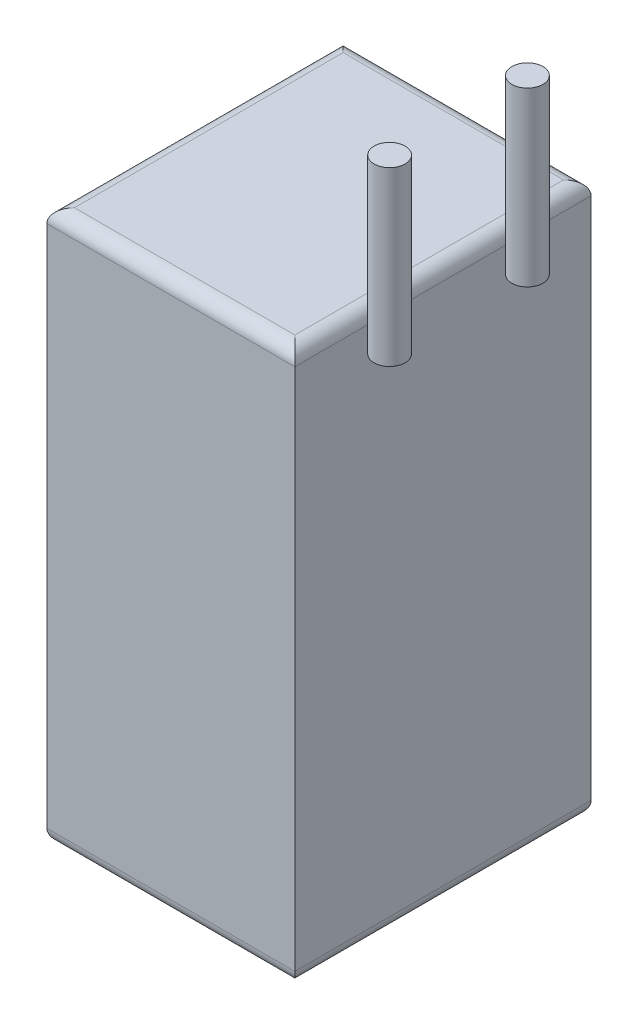
from build123d import *

# Parameters (mm, degrees)
SKETCH1_W                  = 36
SKETCH1_H                  = 43
BOSS_EXTRUDE1_DEPTH        = 80
BOSS_EXTRUDE2_DEPTH        = 20
BOSS_EXTRUDE2_DEPTH_BACK   = 5
SKETCH2_R                  = 2.25
BOSS_EXTRUDE2_2_DEPTH      = 20
BOSS_EXTRUDE2_2_DEPTH_BACK = 5
FILLET1_R                  = 2


with BuildPart() as part:
    # Sketch1 → Boss-Extrude1 (new body)
    with BuildSketch(Plane(origin=(0, 0, 0), x_dir=(1, 0, 0), z_dir=(0, 1, 0))):
        Rectangle(SKETCH1_W, SKETCH1_H)
    extrude(amount=BOSS_EXTRUDE1_DEPTH)

    # Fillet1
    fillet1_edges = [part.edges().sort_by_distance(p)[0] for p in [
        (-18, 80, 0),
        (0, 80, 21.5),
        (18, 80, 0),
        (0, 0, 21.5),
        (-18, 0, 0),
        (0, 0, -21.5),
        (18, 0, 0),
        (0, 80, -21.5),
    ]]
    fillet(fillet1_edges, radius=FILLET1_R)


with BuildPart() as body_2:
    # Sketch2 → Boss-Extrude2 (new, two sides: drawn at the far end of the back side and taken through both)
    with BuildSketch(Plane(origin=(0, 80, 0), x_dir=(1, 0, 0), z_dir=(0, 1, 0)).offset(-BOSS_EXTRUDE2_DEPTH_BACK)):
        with Locations(Location((20.25, 10, 0), (0, 0, 270))):
            Circle(SKETCH2_R)
    extrude(amount=BOSS_EXTRUDE2_DEPTH + BOSS_EXTRUDE2_DEPTH_BACK)


with BuildPart() as body_3:
    # Sketch2 → Boss-Extrude2 2 (new, two sides: drawn at the far end of the back side and taken through both)
    with BuildSketch(Plane(origin=(0, 80, 0), x_dir=(1, 0, 0), z_dir=(0, 1, 0)).offset(-BOSS_EXTRUDE2_2_DEPTH_BACK)):
        with Locations(Location((20.25, -10, 0), (0, 0, 90))):
            Circle(SKETCH2_R)
    extrude(amount=BOSS_EXTRUDE2_2_DEPTH + BOSS_EXTRUDE2_2_DEPTH_BACK)


solid = Compound([part.part, body_2.part, body_3.part])
